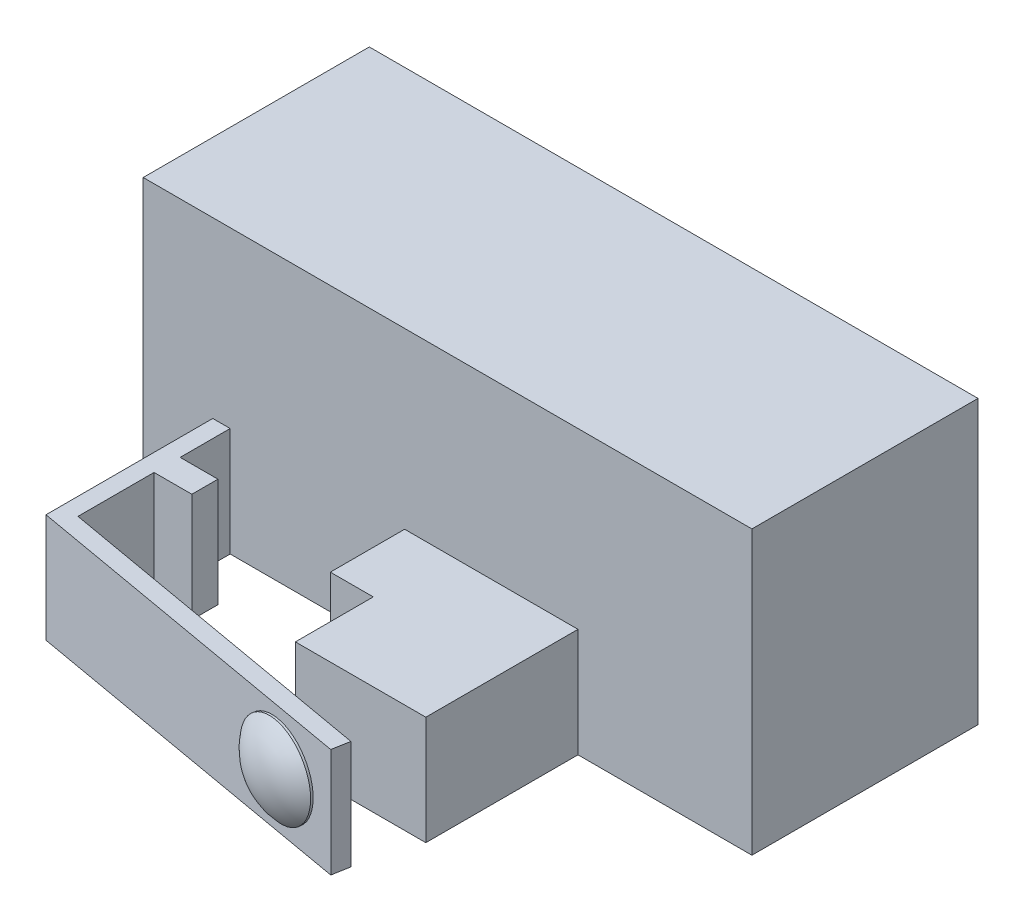
from build123d import *

# Parameters (mm, degrees)
BOSS_EXTRUDE1_DEPTH = 9.6
SKETCH2_W           = 28
SKETCH2_H           = 13
BOSS_EXTRUDE2_DEPTH = 0.8
BOSS_EXTRUDE3_DEPTH = 5
SKETCH4_R           = 2
BOSS_EXTRUDE4_DEPTH = 0.1
DOME1_FACE_RADIUS   = 2
DOME1_HEIGHT        = 0.8


with BuildPart() as part:
    # Sketch1 → Boss-Extrude1 (new body)
    with BuildSketch(Plane.XY):
        Polygon((-16.122641509, -15.877358491), (-12.122641509, -15.877358491), (-12.122641509, -6.877358491), (7.877358491, -6.877358491), (7.877358491, -15.877358491), (11.877358491, -15.877358491), (11.877358491, -2.877358491), (-16.122641509, -2.877358491), align=None)
    extrude(amount=BOSS_EXTRUDE1_DEPTH)

    # Sketch2 → Boss-Extrude2 (add)
    with BuildSketch(Plane.XY.offset(9.6)):
        with Locations((-2.122641509, -9.377358491)):
            Rectangle(SKETCH2_W, SKETCH2_H)
    extrude(amount=BOSS_EXTRUDE2_DEPTH)

    # Sketch3 → Boss-Extrude3 (add)
    with BuildSketch(Plane.XZ.offset(15.877358491)):
        Polygon((-4.096861334, 10.4), (3.877358491, 10.4), (3.877358491, 17.4), (-2.122641509, 17.4), (-2.122641509, 13.817479277), (-4.096861334, 13.817479277), align=None)
        Polygon((-12.122641509, 17.4), (3.119119142, 20.087533636), (2.9802006, 20.875379839), (-12.922641509, 18.071279705), (-12.922641509, 13.961837911), (-12.922641509, 10.4), (-12.122641509, 10.4), (-12.122641509, 12.7), (-10.384503435, 12.7), (-10.384503435, 13.9), (-12.122641509, 13.9), align=None)
    extrude(amount=-BOSS_EXTRUDE3_DEPTH)

    # Sketch4 → Boss-Extrude4 (add)
    with BuildSketch(Plane(origin=(-3.480036158, 0, 19.736265797), x_dir=(0.9848077530122085, 0, 0.17364817766692794), z_dir=(-0.17364817766692794, 0, 0.9848077530122085))):
        with Locations((3.559896323, -13.377358491)):
            Circle(SKETCH4_R)
    extrude(amount=BOSS_EXTRUDE4_DEPTH)

    # Dome1: a dome of height H over a round flat face of radius A is a cap of a sphere of radius (A * A + H * H) / (2 * H)
    dome1_r = (DOME1_FACE_RADIUS * DOME1_FACE_RADIUS + DOME1_HEIGHT * DOME1_HEIGHT) / (2 * DOME1_HEIGHT)
    dome1_base = Plane((0.008412523, -13.377358491, 20.452916081), z_dir=(-0.173648177667, 0, 0.984807753012))
    with Locations(dome1_base.offset(DOME1_HEIGHT - dome1_r)):
        dome1_ball = Sphere(dome1_r, mode=Mode.PRIVATE)
    add(split(dome1_ball, bisect_by=dome1_base, keep=Keep.TOP, mode=Mode.PRIVATE))


solid = part.part
